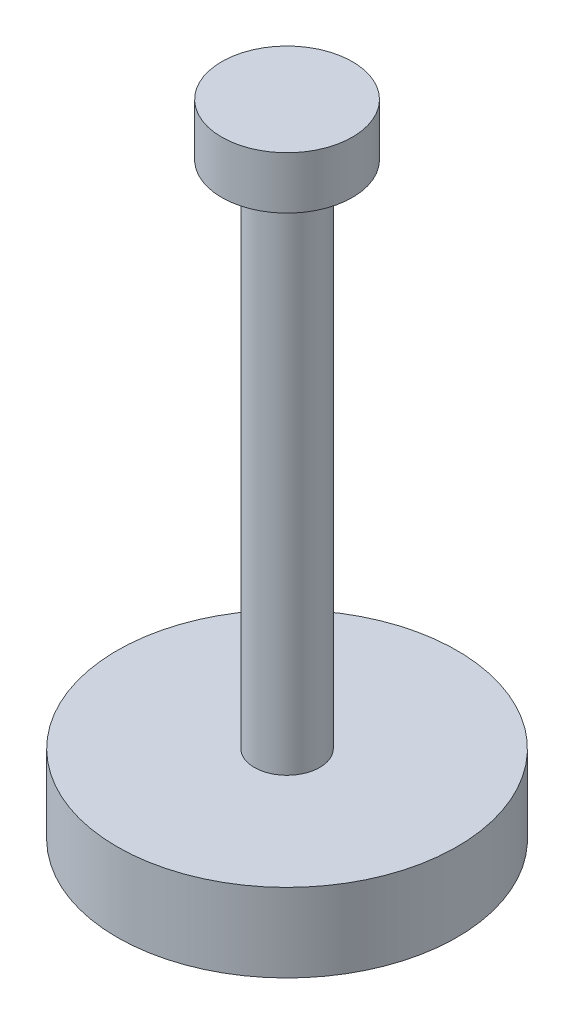
from build123d import *

# Parameters (mm, degrees)
SKETCH1_R           = 6.35
SKETCH1_R_2         = 3.175
BOSS_EXTRUDE1_DEPTH = 5.08
SKETCH1_3_R         = 3.175
BOSS_EXTRUDE2_DEPTH = 49.53
BOSS_EXTRUDE3_START = -49.53
SKETCH1_4_R         = 16.51
SKETCH1_4_R_2       = 6.35
SKETCH1_4_R_3       = 3.175
BOSS_EXTRUDE3_DEPTH = 7.62


with BuildPart() as part:
    # Sketch1 → Boss-Extrude1 (new body)
    # profile 1 of 2: a face of its own
    with BuildSketch(Plane(origin=(0, 0, 0), x_dir=(1, 0, 0), z_dir=(0, 1, 0))):
        with Locations(Location((0, 0, 0), (0, 0, 270))):
            Circle(SKETCH1_R)
        Circle(SKETCH1_R_2, mode=Mode.SUBTRACT)
    # profile 2 of 2: a face of its own
    with BuildSketch(Plane(origin=(0, 0, 0), x_dir=(1, 0, 0), z_dir=(0, 1, 0))):
        Circle(SKETCH1_R_2)
    extrude(amount=BOSS_EXTRUDE1_DEPTH)

    # Sketch1<3> → Boss-Extrude2 (add)
    with BuildSketch(Plane(origin=(0, 0, 0), x_dir=(1, 0, 0), z_dir=(0, 1, 0))):
        with Locations(Location((0, 0, 0), (0, 0, 270))):
            Circle(SKETCH1_3_R)
    extrude(amount=-BOSS_EXTRUDE2_DEPTH)

    # Sketch1<4> → Boss-Extrude3 (add)
    # profile 1 of 3: a face of its own
    with BuildSketch(Plane(origin=(0, 0, 0), x_dir=(1, 0, 0), z_dir=(0, 1, 0)).offset(BOSS_EXTRUDE3_START)):
        with Locations(Location((0, 0, 0), (0, 0, 270))):
            Circle(SKETCH1_4_R)
        with Locations(Location((0, 0, 0), (0, 0, 270))):
            Circle(SKETCH1_4_R_2, mode=Mode.SUBTRACT)
    # profile 2 of 3: a face of its own
    with BuildSketch(Plane(origin=(0, 0, 0), x_dir=(1, 0, 0), z_dir=(0, 1, 0)).offset(BOSS_EXTRUDE3_START)):
        with Locations(Location((0, 0, 0), (0, 0, 270))):
            Circle(SKETCH1_4_R_2)
        with Locations(Location((0, 0, 0), (0, 0, 270))):
            Circle(SKETCH1_4_R_3, mode=Mode.SUBTRACT)
    # profile 3 of 3: a face of its own
    with BuildSketch(Plane(origin=(0, 0, 0), x_dir=(1, 0, 0), z_dir=(0, 1, 0)).offset(BOSS_EXTRUDE3_START)):
        with Locations(Location((0, 0, 0), (0, 0, 270))):
            Circle(SKETCH1_4_R_3)
    extrude(amount=-BOSS_EXTRUDE3_DEPTH)


solid = part.part
